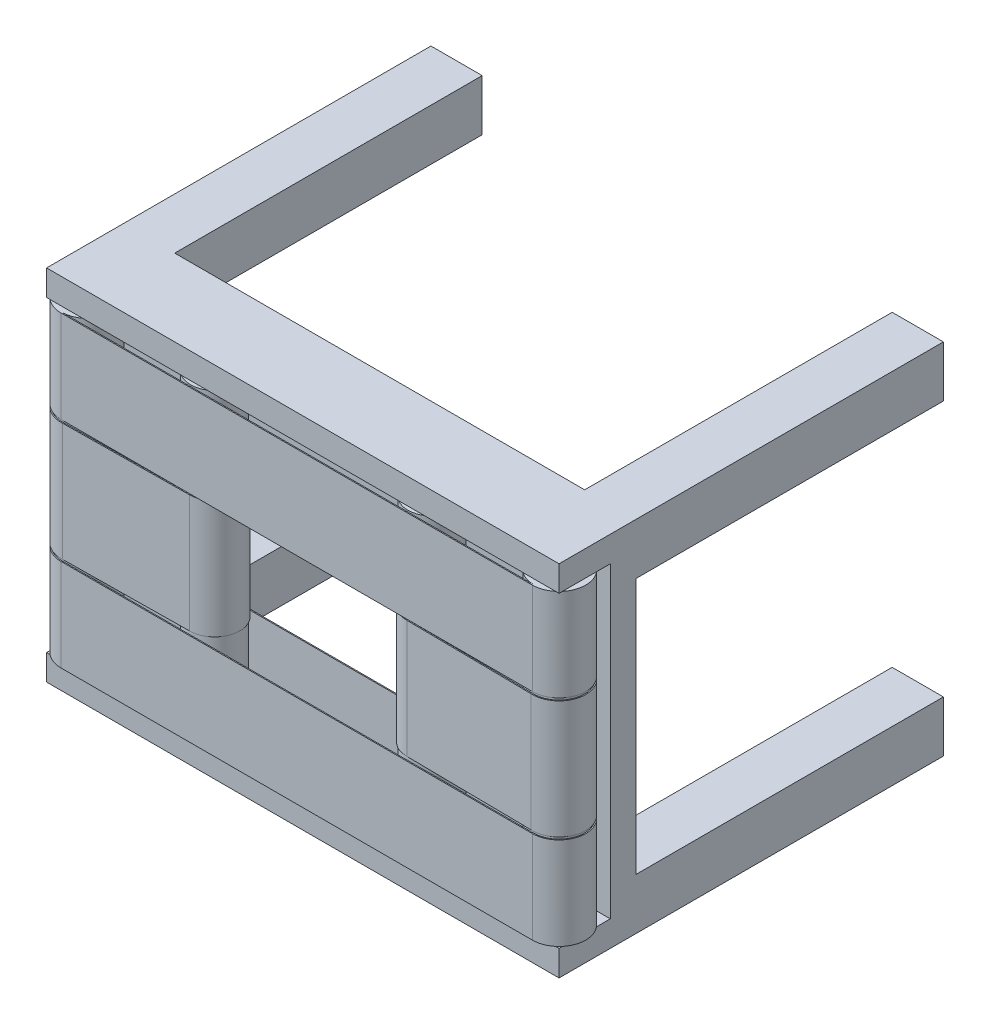
from build123d import *

# Parameters (mm, degrees)
SKETCH1_W            = 1000
SKETCH1_H            = 700
SKETCH1_W_2          = 900
SKETCH1_H_2          = 600
BOSS_EXTRUDE1_DEPTH  = 150
SKETCH2_W            = 100
SKETCH2_H            = 600
CUT_EXTRUDE1_DEPTH   = 1000
SKETCH3_R            = 50
BOSS_EXTRUDE2_DEPTH  = 600
BOSS_EXTRUDE3_START  = -180
BOSS_EXTRUDE3_DEPTH  = 180
SKETCH5_W            = 100
SKETCH5_H            = 100
BOSS_EXTRUDE4_DEPTH  = 600
SKETCH7_R            = 47
BOSS_EXTRUDE15_DEPTH = 600
BOSS_EXTRUDE16_DEPTH = 115


with BuildPart() as part:
    # Sketch1 → Boss-Extrude1 (new body)
    with BuildSketch(Plane.XY):
        Rectangle(SKETCH1_W, SKETCH1_H)
        Rectangle(SKETCH1_W_2, SKETCH1_H_2, mode=Mode.SUBTRACT)
    extrude(amount=BOSS_EXTRUDE1_DEPTH)

    # Sketch2 → Cut-Extrude1 (cut)
    with BuildSketch(Plane(origin=(500, 0, 0), x_dir=(0, 0, -1), z_dir=(1, 0, 0))):
        with Locations((-100, 0)):
            Rectangle(SKETCH2_W, SKETCH2_H)
    extrude(amount=-CUT_EXTRUDE1_DEPTH, mode=Mode.SUBTRACT)

    # Sketch3 → Boss-Extrude2 (add)
    with BuildSketch(Plane.XZ.offset(-300)):
        with Locations(Location((460, 110, 0), (0, 0, 126.869897646))):
            Circle(SKETCH3_R)
    boss_extrude2 = extrude(amount=BOSS_EXTRUDE2_DEPTH)

    # Mirror1: Boss-Extrude2 across plane
    add(boss_extrude2.mirror(Plane(origin=(0, 0, 0), x_dir=(0, 0, 1), z_dir=(1, 0, 0))))

    # Sketch4 → Boss-Extrude3 (add)
    with BuildSketch(Plane.XZ.offset(300).offset(BOSS_EXTRUDE3_START)):
        with BuildLine():
            Line((-460, 162), (460, 162))
            ThreePointArc((460, 162), (512, 110), (460, 58))
            Line((460, 58), (-460, 58))
            ThreePointArc((-460, 58), (-512, 110), (-460, 162))
        make_face()
        with BuildLine():
            Line((-460, 160), (460, 160))
            ThreePointArc((460, 160), (510, 110), (460, 60))
            Line((460, 60), (-460, 60))
            ThreePointArc((-460, 60), (-510, 110), (-460, 160))
        make_face(mode=Mode.SUBTRACT)
    boss_extrude3 = extrude(amount=BOSS_EXTRUDE3_DEPTH)

    # Mirror2: Boss-Extrude3 across plane
    add(boss_extrude3.mirror(Plane.ZX))

    # Sketch5 → Boss-Extrude4 (add)
    with BuildSketch(Plane(origin=(0, 0, 0), x_dir=(-1, 0, 0), z_dir=(0, 0, -1))):
        with Locations((-450, 300)):
            Rectangle(SKETCH5_W, SKETCH5_H)
        with Locations((450, 300)):
            Rectangle(SKETCH5_W, SKETCH5_H)
        with Locations((450, -300)):
            Rectangle(SKETCH5_W, SKETCH5_H)
        with Locations((-450, -300)):
            Rectangle(SKETCH5_W, SKETCH5_H)
    extrude(amount=BOSS_EXTRUDE4_DEPTH)

    # Sketch7 → Boss-Extrude15 (add)
    with BuildSketch(Plane.XZ.offset(-300)):
        with Locations(Location((-212, 110, 0), (0, 0, 121.672433426))):
            Circle(SKETCH7_R)
    boss_extrude15 = extrude(amount=BOSS_EXTRUDE15_DEPTH)

    # Sketch10 → Boss-Extrude16 (add, symmetric)
    with BuildSketch(Plane(origin=(0, 0, 0), x_dir=(1, 0, 0), z_dir=(0, 1, 0))):
        with BuildLine():
            Line((-211.988019901, -158.999998535), (-456.82601912, -161.903042737))
            ThreePointArc((-456.82601912, -161.903042737), (-512, -110), (-456.82601912, -58.096957263))
            Line((-456.82601912, -58.096957263), (-211.988019901, -61.000001465))
            ThreePointArc((-211.988019901, -61.000001465), (-163, -110), (-211.988019901, -158.999998535))
        make_face()
        with BuildLine():
            Line((-212, -157), (-456.899440499, -159.903772711))
            ThreePointArc((-456.899440499, -159.903772711), (-510, -110), (-456.899440499, -60.096227289))
            Line((-456.899440499, -60.096227289), (-212, -63))
            ThreePointArc((-212, -63), (-165, -110), (-212, -157))
        make_face(mode=Mode.SUBTRACT)
    boss_extrude16 = extrude(amount=BOSS_EXTRUDE16_DEPTH, both=True)

    # Mirror3: Boss-Extrude15, Boss-Extrude16 across plane
    add(boss_extrude15.mirror(Plane(origin=(0, 0, 0), x_dir=(0, 0, 1), z_dir=(1, 0, 0))))
    add(boss_extrude16.mirror(Plane(origin=(0, 0, 0), x_dir=(0, 0, 1), z_dir=(1, 0, 0))))


solid = part.part
